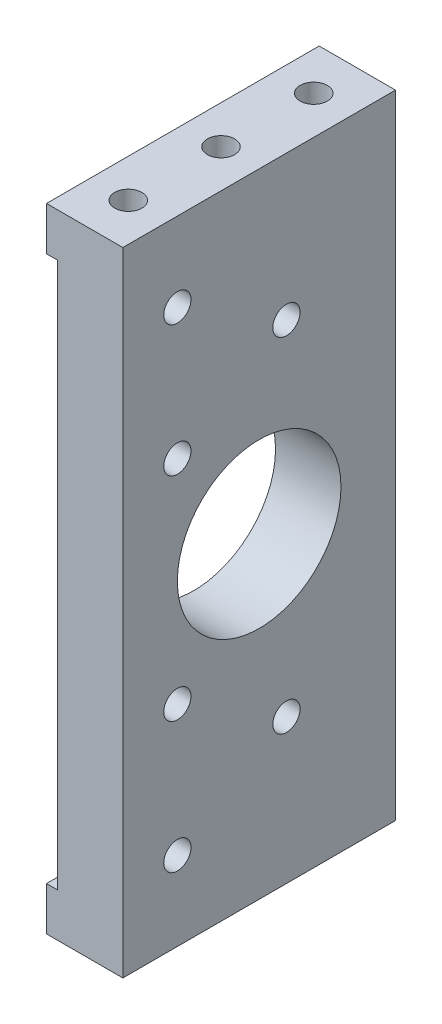
from build123d import *

# Parameters (mm, degrees)
EXTRUDE_1_DEPTH             = 25
SKETCH_2_W                  = 1
SKETCH_2_H                  = 50
CUT_EXTRUDE_1_DEPTH         = 96.796659649
SKETCH_3_W                  = 52
SKETCH_3_H                  = 1
EXTRUDE_2_DEPTH             = 25
SKETCH_4_W                  = 2
SKETCH_4_H                  = 1
EXTRUDE_3_DEPTH             = 25
SKETCH_5_W                  = 2
SKETCH_5_H                  = 1
EXTRUDE_4_DEPTH             = 25
SKETCH_6_W                  = 11
SKETCH_6_H                  = 1
CUT_EXTRUDE_2_DEPTH         = 96.796659649
SKETCH_7_R                  = 8.5
CUT_EXTRUDE_3_DEPTH         = 110.498858442
SKETCH_8_R                  = 9.5
CUT_EXTRUDE_4_DEPTH         = 5
SKETCH_9_W                  = 2
SKETCH_9_H                  = 5
EXTRUDE_5_DEPTH             = 25
HOLE_WIZARD_1_D             = 3.4
HOLE_WIZARD_1_CBORE_D       = 6
HOLE_WIZARD_1_CBORE_DEPTH   = 3
CUT_EXTRUDE_8_REACH         = 110.927
SKETCH_14_R                 = 1.5
SKETCH_22_W                 = 25
SKETCH_22_H                 = 52
EXTRUDE_9_DEPTH             = 2
CUT_EXTRUDE_10_REACH        = 111.499
CUT_EXTRUDE_11_REACH        = 178.131
SKETCH_17_R                 = 7.5
CUT_EXTRUDE_12_DEPTH        = 60
HOLE_WIZARD_M3_1_D          = 2.5
HOLE_WIZARD_M3_1_DEPTH      = 8.5
HOLE_WIZARD_M3_1_TIP        = 0.751075774
HOLE_WIZARD_M3_2_AT_2_COUNT = 2
HOLE_WIZARD_M3_2_AT_2_PITCH = 8.5
HOLE_WIZARD_M3_2_AT_3_COUNT = 2
HOLE_WIZARD_M3_2_AT_3_PITCH = 17


with BuildPart() as part:
    # 草图1 → 凸台-拉伸1 (new body)
    with BuildSketch(Plane.XY):
        Polygon((-81, -29), (86, -29), (86, -34), (-86, -34), (-86, -29), (-86, 29), (-81, 29), align=None)
    extrude(amount=EXTRUDE_1_DEPTH)

    # 草图2 → 切除-拉伸1 (cut, through all)
    with BuildSketch(Plane.XY.offset(25)):
        with Locations((-85.5, 0)):
            Rectangle(SKETCH_2_W, SKETCH_2_H)
    extrude(amount=-CUT_EXTRUDE_1_DEPTH, mode=Mode.SUBTRACT)

    # 草图3 → 凸台-拉伸2 (add)
    with BuildSketch(Plane.XY.offset(25)):
        with Locations((0, -28.5)):
            Rectangle(SKETCH_3_W, SKETCH_3_H)
    extrude(amount=-EXTRUDE_2_DEPTH)

    # 草图4 → 凸台-拉伸3 (add)
    with BuildSketch(Plane.XY.offset(25)):
        with Locations((-80, -28.5)):
            Rectangle(SKETCH_4_W, SKETCH_4_H)
    extrude(amount=-EXTRUDE_3_DEPTH)

    # 草图5 → 凸台-拉伸4 (add)
    with BuildSketch(Plane.XY.offset(25)):
        with Locations((78, -28.5)):
            Rectangle(SKETCH_5_W, SKETCH_5_H)
    extrude(amount=-EXTRUDE_4_DEPTH)

    # 草图6 → 切除-拉伸2 (cut, through all)
    with BuildSketch(Plane.XY.offset(25)):
        with Locations((-20.5, -33.5)):
            Rectangle(SKETCH_6_W, SKETCH_6_H)
    cut_extrude_2 = extrude(amount=-CUT_EXTRUDE_2_DEPTH, mode=Mode.SUBTRACT)

    # 镜向1: 切除-拉伸2 across plane
    add(cut_extrude_2.mirror(Plane(origin=(0, 0, 0), x_dir=(0, 0, 1), z_dir=(1, 0, 0))), mode=Mode.SUBTRACT)

    # 草图7 → 切除-拉伸3 (cut, through all)
    with BuildSketch(Plane.XZ.offset(34)):
        with Locations((0, 12.5)):
            Circle(SKETCH_7_R)
    extrude(amount=-CUT_EXTRUDE_3_DEPTH, mode=Mode.SUBTRACT)

    # 草图8 → 切除-拉伸4 (cut)
    with BuildSketch(Plane(origin=(0, -28, 0), x_dir=(1, 0, 0), z_dir=(0, 1, 0))):
        with Locations(Location((0, -12.5, 0), (0, 0, 270))):
            Circle(SKETCH_8_R)
    extrude(amount=-CUT_EXTRUDE_4_DEPTH, mode=Mode.SUBTRACT)

    # 草图9 → 凸台-拉伸5 (add)
    with BuildSketch(Plane(origin=(0, 0, 0), x_dir=(-1, 0, 0), z_dir=(0, 0, -1))):
        with Locations((80, 26.5)):
            Rectangle(SKETCH_9_W, SKETCH_9_H)
    extrude(amount=-EXTRUDE_5_DEPTH)

    # 孔1 (through all)
    with Locations(Plane(origin=(82.5, -34, 21), x_dir=(-1, 0, 0), z_dir=(0, -1, 0))):
        with Locations((0, 0), (0, 8.5), (0, 17)):
            CounterBoreHole(HOLE_WIZARD_1_D / 2, HOLE_WIZARD_1_CBORE_D / 2, HOLE_WIZARD_1_CBORE_DEPTH)

    # 草图14 → 切除-拉伸8 (cut, up to next)
    with BuildSketch(Plane.XZ.offset(33), mode=Mode.PRIVATE) as cut_extrude_8_sk1:
        with Locations(Location((-23, 20, 0), (0, 0, 270))):
            Circle(SKETCH_14_R)
    cut_extrude_8_tool1 = extrude(cut_extrude_8_sk1.sketch, amount=-CUT_EXTRUDE_8_REACH, mode=Mode.PRIVATE) & part.part
    # 草图14 → 切除-拉伸8 (cut, up to next)
    with BuildSketch(Plane.XZ.offset(33), mode=Mode.PRIVATE) as cut_extrude_8_sk2:
        with Locations(Location((-23, 5, 0), (0, 0, 270))):
            Circle(SKETCH_14_R)
    cut_extrude_8_tool2 = extrude(cut_extrude_8_sk2.sketch, amount=-CUT_EXTRUDE_8_REACH, mode=Mode.PRIVATE) & part.part
    cut_extrude_8_1 = cut_extrude_8_tool1.solids().sort_by_distance((-23, -33, 20))[0]
    add(cut_extrude_8_1, mode=Mode.SUBTRACT)
    cut_extrude_8_2 = cut_extrude_8_tool2.solids().sort_by_distance((-23, -33, 5))[0]
    add(cut_extrude_8_2, mode=Mode.SUBTRACT)
    cut_extrude_8 = cut_extrude_8_1 + cut_extrude_8_2  # 切除-拉伸8 as one shape, for the pattern or mirror that repeats it

    # 镜向2: 切除-拉伸8 across plane
    add(cut_extrude_8.mirror(Plane(origin=(0, 0, 0), x_dir=(0, 0, 1), z_dir=(1, 0, 0))), mode=Mode.SUBTRACT)

    # 草图22 → 凸台-拉伸9 (add)
    with BuildSketch(Plane(origin=(-81, 0, 0), x_dir=(0, 0, -1), z_dir=(1, 0, 0))):
        with Locations((-12.5, -2)):
            Rectangle(SKETCH_22_W, SKETCH_22_H)
    extrude(amount=EXTRUDE_9_DEPTH)

    # 草图16 → 切除-拉伸10 (cut, up to next)
    with BuildSketch(Plane.XZ.offset(34), mode=Mode.PRIVATE) as cut_extrude_10_sk1:
        with BuildLine():
            Line((-73, 20), (-30, 20))
            ThreePointArc((-30, 20), (-26.464466094, 18.535533906), (-25, 15))
            Line((-25, 15), (-25, 10))
            ThreePointArc((-25, 10), (-26.464466094, 6.464466094), (-30, 5))
            Line((-30, 5), (-73, 5))
            ThreePointArc((-73, 5), (-76.535533906, 6.464466094), (-78, 10))
            Line((-78, 10), (-78, 15))
            ThreePointArc((-78, 15), (-76.535533906, 18.535533906), (-73, 20))
        make_face()
    cut_extrude_10_tool1 = extrude(cut_extrude_10_sk1.sketch, amount=-CUT_EXTRUDE_10_REACH, mode=Mode.PRIVATE) & part.part
    cut_extrude_10 = cut_extrude_10_tool1.solids().sort_by_distance((-51.5, -34, 12.5))[0]
    add(cut_extrude_10, mode=Mode.SUBTRACT)

    # 镜向3: 切除-拉伸10 mirrored; each copy of 切除-拉伸10 runs up to whatever stops it at its own place
    mirror_3_before = part.part  # the part as the pattern finds it: every copy runs up to it
    mirror_3_cut_extrude_10_long = extrude(cut_extrude_10_sk1.sketch, amount=-CUT_EXTRUDE_10_REACH, mode=Mode.PRIVATE)
    mirror_3_cut_extrude_10_tool1 = mirror_3_cut_extrude_10_long.mirror(Plane(origin=(0, 0, 0), x_dir=(0, 0, 1), z_dir=(1, 0, 0))) & mirror_3_before
    add(mirror_3_cut_extrude_10_tool1.solids().sort_by_distance((51.5, -34, 12.5))[0], mode=Mode.SUBTRACT)

    # 草图17 → 切除-拉伸11 (cut, up to next)
    with BuildSketch(Plane.ZY.offset(85), mode=Mode.PRIVATE) as cut_extrude_11_sk1:
        with Locations((12.5, 0)):
            Circle(SKETCH_17_R)
    cut_extrude_11_tool1 = extrude(cut_extrude_11_sk1.sketch, amount=-CUT_EXTRUDE_11_REACH, mode=Mode.PRIVATE) & part.part
    add(cut_extrude_11_tool1.solids().sort_by_distance((-85, 0, 12.5))[0], mode=Mode.SUBTRACT)

    # 草图18 → 切除-拉伸12 (cut)
    with BuildSketch(Plane.XY.offset(25)):
        Polygon((-79, -29), (-86, -29), (-86, -34), (86, -34), (86, -25.759087468), (-79, -25.759087468), align=None)
    extrude(amount=-CUT_EXTRUDE_12_DEPTH, mode=Mode.SUBTRACT)

    # M3 螺纹孔1
    with Locations(Plane(origin=(-85, 21.75, 20), x_dir=(0, 0, -1), z_dir=(-1, 0, 0))):
        with Locations((0, 0), (0, 12), (10, 6), (0, 31.5), (0, 43.5), (10, 37.5)):
            Hole(HOLE_WIZARD_M3_1_D / 2, depth=HOLE_WIZARD_M3_1_DEPTH)
            with Locations((0, 0, -(HOLE_WIZARD_M3_1_DEPTH + HOLE_WIZARD_M3_1_TIP / 2))):  # 118° drill point
                Cone(0, HOLE_WIZARD_M3_1_D / 2, HOLE_WIZARD_M3_1_TIP, mode=Mode.SUBTRACT)

    # 草图24 → M3 螺纹孔2 (revolve, cut)
    with BuildSketch(Plane(origin=(-82.5, 29, 21), x_dir=(0, 0, 1), z_dir=(1, 0, 0))):
        Polygon((0, 0), (0, 5.751075774), (1.25, 5), (1.25, 0), align=None)
    hole_wizard_m3_2 = revolve(axis=Axis((-82.5, 35.35, 21), (0, -1, 0)), mode=Mode.SUBTRACT)

    # M3 螺纹孔2 at 2: M3 螺纹孔2 ×2
    with Locations(*[(0, 0, -i * HOLE_WIZARD_M3_2_AT_2_PITCH) for i in range(1, HOLE_WIZARD_M3_2_AT_2_COUNT)]):
        add(hole_wizard_m3_2, mode=Mode.SUBTRACT)

    # M3 螺纹孔2 at 3: M3 螺纹孔2 ×2
    with Locations(*[(0, 0, -i * HOLE_WIZARD_M3_2_AT_3_PITCH) for i in range(1, HOLE_WIZARD_M3_2_AT_3_COUNT)]):
        add(hole_wizard_m3_2, mode=Mode.SUBTRACT)

    # 镜向4: M3 螺纹孔2 across plane
    add(hole_wizard_m3_2.mirror(Plane.ZX), mode=Mode.SUBTRACT)

    # 镜向4 copy 1 sketch → 镜向4 copy 1 (revolve, cut)
    with BuildSketch(Plane(origin=(-82.5, -29, 12.5), x_dir=(0, 0, 1), z_dir=(1, 0, 0))):
        Polygon((0, 0), (0, -5.751075774), (1.25, -5), (1.25, 0), align=None)
    revolve(axis=Axis((-82.5, -35.35, 12.5), (0, -1, 0)), mode=Mode.SUBTRACT)

    # 镜向4 copy 2 sketch → 镜向4 copy 2 (revolve, cut)
    with BuildSketch(Plane(origin=(-82.5, -29, 4), x_dir=(0, 0, 1), z_dir=(1, 0, 0))):
        Polygon((0, 0), (0, -5.751075774), (1.25, -5), (1.25, 0), align=None)
    revolve(axis=Axis((-82.5, -35.35, 4), (0, -1, 0)), mode=Mode.SUBTRACT)


solid = part.part
